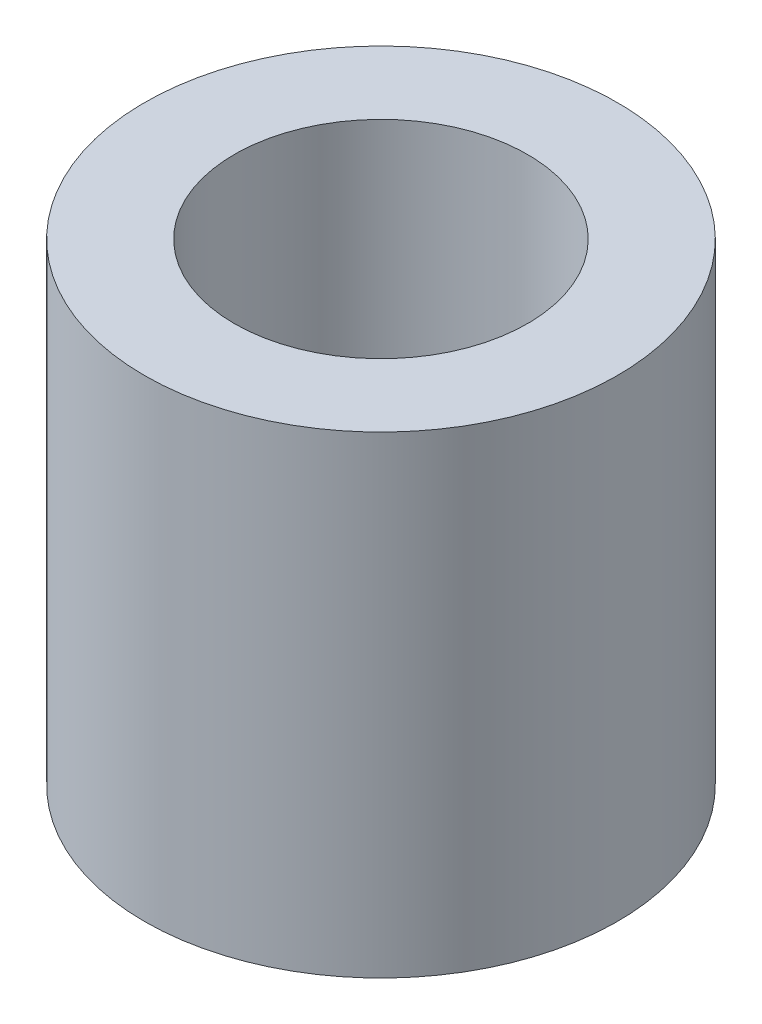
from build123d import *

# Parameters (mm, degrees)
SKETCH1_R           = 5
SKETCH1_R_2         = 3.1
BOSS_EXTRUDE1_DEPTH = 10


with BuildPart() as part:
    # Sketch1 → Boss-Extrude1 (new body)
    with BuildSketch(Plane(origin=(0, 0, 0), x_dir=(1, 0, 0), z_dir=(0, 1, 0))):
        with Locations(Location((0, 0, 0), (0, 0, 270))):
            Circle(SKETCH1_R)
        with Locations(Location((0, 0, 0), (0, 0, 270))):
            Circle(SKETCH1_R_2, mode=Mode.SUBTRACT)
    extrude(amount=BOSS_EXTRUDE1_DEPTH)


solid = part.part
